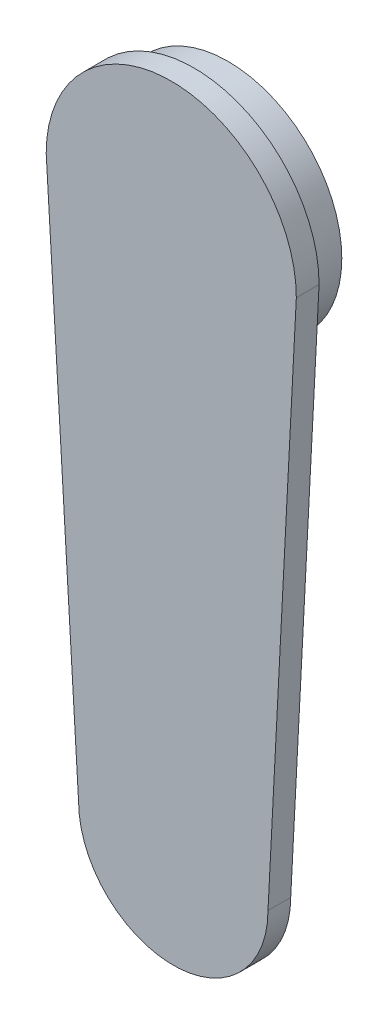
from build123d import *

# Parameters (mm, degrees)
BOSS_EXTRUDE1_DEPTH      = 10
BOSS_EXTRUDE1_DEPTH_BACK = 0.0001
SKETCH2_R                = 50
BOSS_EXTRUDE2_DEPTH      = 15


with BuildPart() as part:
    # Sketch1 → Boss-Extrude1 (new, two sides: drawn at the far end of the back side and taken through both)
    with BuildSketch(Plane.XY.offset(-BOSS_EXTRUDE1_DEPTH_BACK)):
        with BuildLine():
            ThreePointArc((55, 0), (0, 55), (-55, 0))
            Line((-55, 0), (-40.768073077, -239.675921097))
            ThreePointArc((-40.768073077, -239.675921097), (0.881926923, -281.325921097), (42.531926923, -239.675921097))
            Line((42.531926923, -239.675921097), (55, 0))
        make_face()
    extrude(amount=BOSS_EXTRUDE1_DEPTH + BOSS_EXTRUDE1_DEPTH_BACK)

    # Sketch2 → Boss-Extrude2 (add)
    with BuildSketch(Plane(origin=(0, 0, -0.0001), x_dir=(-1, 0, 0), z_dir=(0, 0, -1))):
        with Locations(Location((0, 0, 0), (0, 0, 180))):
            Circle(SKETCH2_R)
    extrude(amount=BOSS_EXTRUDE2_DEPTH)


solid = part.part
